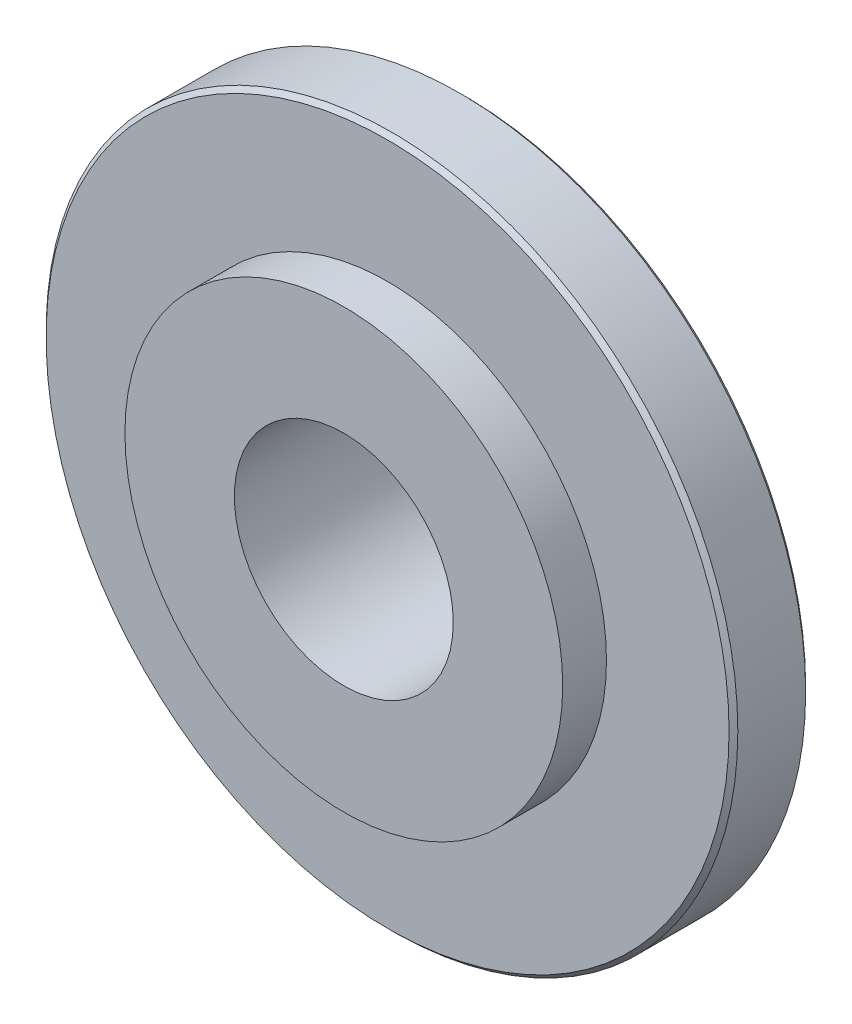
from build123d import *

# Parameters (mm, degrees)
SKETCH_1_R          = 10
EXTRUDE_1_DEPTH     = 2
SKETCH_2_R          = 15.8
EXTRUDE_2_DEPTH     = 3.5
SKETCH_3_R          = 10
EXTRUDE_3_DEPTH     = 2
SKETCH_4_R          = 5
CUT_EXTRUDE_1_DEPTH = 10
CHAMFER_1_SIZE      = 0.2


with BuildPart() as part:
    # 草图1 → 凸台-拉伸1 (new body)
    with BuildSketch(Plane.XY):
        Circle(SKETCH_1_R)
    extrude(amount=EXTRUDE_1_DEPTH)

    # 草图2 → 凸台-拉伸2 (add)
    with BuildSketch(Plane.XY.offset(2)):
        Circle(SKETCH_2_R)
    extrude(amount=EXTRUDE_2_DEPTH)

    # 草图3 → 凸台-拉伸3 (add)
    with BuildSketch(Plane.XY.offset(5.5)):
        Circle(SKETCH_3_R)
    extrude(amount=EXTRUDE_3_DEPTH)

    # 草图4 → 切除-拉伸1 (cut)
    with BuildSketch(Plane.XY.offset(7.5)):
        Circle(SKETCH_4_R)
    extrude(amount=-CUT_EXTRUDE_1_DEPTH, mode=Mode.SUBTRACT)

    # 倒角1
    chamfer_1_edges = [part.edges().sort_by_distance(p)[0] for p in [
        (-15.8, 0, 2),
        (-15.8, 0, 5.5),
    ]]
    chamfer(chamfer_1_edges, length=CHAMFER_1_SIZE)


solid = part.part
